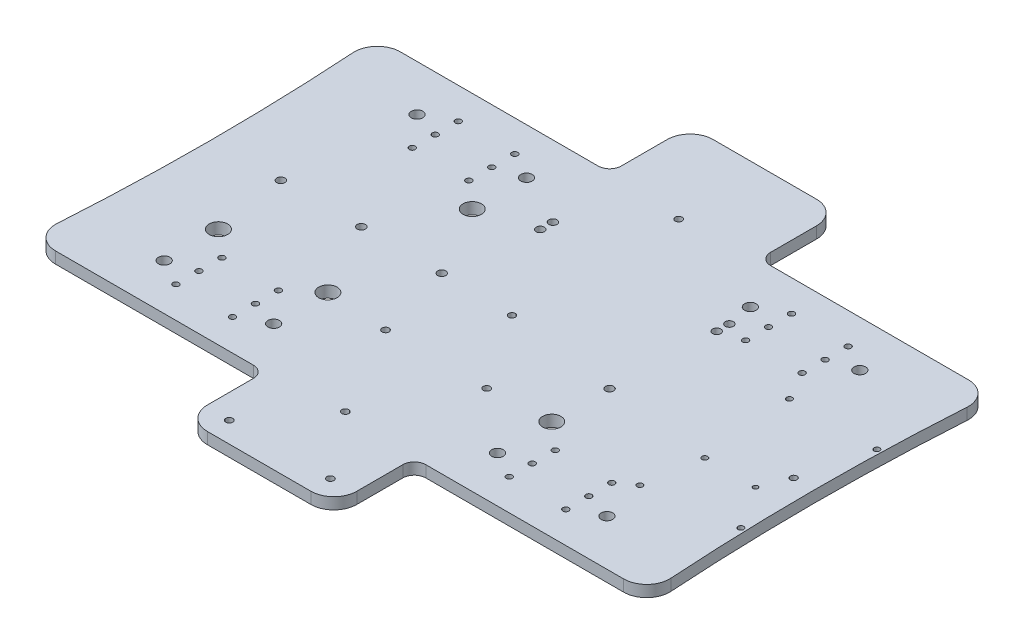
from build123d import *

# Parameters (mm, degrees)
SKETCH1_R              = 1.651
SKETCH1_R_2            = 1.8415
SKETCH1_R_3            = 1.905
SKETCH1_R_4            = 3.175
SKETCH1_R_5            = 1.315256363
SKETCH1_R_6            = 1.5621
SKETCH1_R_7            = 5.08
SKETCH1_R_8            = 2.2479
BOSS_EXTRUDE1_DEPTH    = 6.35
FILLET_OUTER_CORNERS_R = 12.7
FILLET_INNER_CORNERS_R = 6.35
SKETCH2_R              = 5.08
CUT_EXTRUDE1_DEPTH     = 220.86103505


with BuildPart() as part:
    # Sketch1 → Boss-Extrude1 (new body)
    with BuildSketch(Plane(origin=(0, 0, 0), x_dir=(1, 0, 0), z_dir=(0, 1, 0))):
        with BuildLine():
            Line((-142.875, 95.25), (-41.275, 95.25))
            Line((-41.275, 95.25), (-41.275, 139.7))
            Line((-41.275, 139.7), (41.275, 139.7))
            Line((41.275, 139.7), (41.275, 95.25))
            Line((41.275, 95.25), (142.875, 95.25))
            Line((142.875, 95.25), (170.571792564, 95.25))
            ThreePointArc((170.571792564, 95.25), (166.994880438, 0), (170.571792564, -95.25))
            Line((170.571792564, -95.25), (142.875, -95.25))
            Line((142.875, -95.25), (41.275, -95.25))
            Line((41.275, -95.25), (41.275, -139.7))
            Line((41.275, -139.7), (-41.275, -139.7))
            Line((-41.275, -139.7), (-41.275, -95.25))
            Line((-41.275, -95.25), (-142.875, -95.25))
            Line((-142.875, -95.25), (-170.571792564, -95.25))
            ThreePointArc((-170.571792564, -95.25), (-166.994880438, 0), (-170.571792564, 95.25))
            Line((-170.571792564, 95.25), (-142.875, 95.25))
        make_face()
        with Locations(Location((-107.696, 77.978, 0), (0, 0, 270))):
            Circle(SKETCH1_R, mode=Mode.SUBTRACT)
        with Locations(Location((-107.696, 65.278, 0), (0, 0, 270))):
            Circle(SKETCH1_R, mode=Mode.SUBTRACT)
        with Locations(Location((-107.696, 52.578, 0), (0, 0, 270))):
            Circle(SKETCH1_R, mode=Mode.SUBTRACT)
        with Locations(Location((-76.454, 77.978, 0), (0, 0, 90))):
            Circle(SKETCH1_R, mode=Mode.SUBTRACT)
        with Locations(Location((-76.454, 65.278, 0), (0, 0, 90))):
            Circle(SKETCH1_R, mode=Mode.SUBTRACT)
        with Locations(Location((-76.454, 52.578, 0), (0, 0, 90))):
            Circle(SKETCH1_R, mode=Mode.SUBTRACT)
        with Locations(Location((76.454, 52.578, 0), (0, 0, 270))):
            Circle(SKETCH1_R, mode=Mode.SUBTRACT)
        with Locations(Location((107.696, 52.578, 0), (0, 0, 90))):
            Circle(SKETCH1_R, mode=Mode.SUBTRACT)
        with Locations(Location((76.454, 65.278, 0), (0, 0, 270))):
            Circle(SKETCH1_R, mode=Mode.SUBTRACT)
        with Locations(Location((107.696, 65.278, 0), (0, 0, 90))):
            Circle(SKETCH1_R, mode=Mode.SUBTRACT)
        with Locations(Location((76.454, 77.978, 0), (0, 0, 270))):
            Circle(SKETCH1_R, mode=Mode.SUBTRACT)
        with Locations(Location((107.696, 77.978, 0), (0, 0, 90))):
            Circle(SKETCH1_R, mode=Mode.SUBTRACT)
        with Locations(Location((76.454, -52.578, 0), (0, 0, 90))):
            Circle(SKETCH1_R, mode=Mode.SUBTRACT)
        with Locations(Location((107.696, -52.578, 0), (0, 0, 270))):
            Circle(SKETCH1_R, mode=Mode.SUBTRACT)
        with Locations(Location((107.696, -65.278, 0), (0, 0, 270))):
            Circle(SKETCH1_R, mode=Mode.SUBTRACT)
        with Locations(Location((76.454, -65.278, 0), (0, 0, 90))):
            Circle(SKETCH1_R, mode=Mode.SUBTRACT)
        with Locations(Location((107.696, -77.978, 0), (0, 0, 270))):
            Circle(SKETCH1_R, mode=Mode.SUBTRACT)
        with Locations(Location((76.454, -77.978, 0), (0, 0, 90))):
            Circle(SKETCH1_R, mode=Mode.SUBTRACT)
        with Locations(Location((-76.454, -52.578, 0), (0, 0, 270))):
            Circle(SKETCH1_R, mode=Mode.SUBTRACT)
        with Locations(Location((-107.696, -52.578, 0), (0, 0, 90))):
            Circle(SKETCH1_R, mode=Mode.SUBTRACT)
        with Locations(Location((-76.454, -65.278, 0), (0, 0, 270))):
            Circle(SKETCH1_R, mode=Mode.SUBTRACT)
        with Locations(Location((-107.696, -65.278, 0), (0, 0, 90))):
            Circle(SKETCH1_R, mode=Mode.SUBTRACT)
        with Locations(Location((-76.454, -77.978, 0), (0, 0, 270))):
            Circle(SKETCH1_R, mode=Mode.SUBTRACT)
        with Locations(Location((-107.696, -77.978, 0), (0, 0, 90))):
            Circle(SKETCH1_R, mode=Mode.SUBTRACT)
        with Locations(Location((155.575, 0, 0), (0, 0, 270))):
            Circle(SKETCH1_R_2, mode=Mode.SUBTRACT)
        with Locations(Location((-27.94, -128.27, 0), (0, 0, 270))):
            Circle(SKETCH1_R_3, mode=Mode.SUBTRACT)
        with Locations(Location((27.94, -128.27, 0), (0, 0, 270))):
            Circle(SKETCH1_R_3, mode=Mode.SUBTRACT)
        with Locations(Location((-27.94, -41.91, 0), (0, 0, 90))):
            Circle(SKETCH1_R_3, mode=Mode.SUBTRACT)
        with Locations(Location((27.94, -41.91, 0), (0, 0, 90))):
            Circle(SKETCH1_R_3, mode=Mode.SUBTRACT)
        with Locations(Location((0, 0, 0), (0, 0, 270))):
            Circle(SKETCH1_R_2, mode=Mode.SUBTRACT)
        with Locations(Location((-122.311792564, 69.85, 0), (0, 0, 270))):
            Circle(SKETCH1_R_4, mode=Mode.SUBTRACT)
        with Locations(Location((-61.838207436, 69.85, 0), (0, 0, 90))):
            Circle(SKETCH1_R_4, mode=Mode.SUBTRACT)
        with Locations(Location((-61.838207436, -69.85, 0), (0, 0, 270))):
            Circle(SKETCH1_R_4, mode=Mode.SUBTRACT)
        with Locations(Location((-122.311792564, -69.85, 0), (0, 0, 90))):
            Circle(SKETCH1_R_4, mode=Mode.SUBTRACT)
        with Locations(Location((61.838207436, -69.85, 0), (0, 0, 90))):
            Circle(SKETCH1_R_4, mode=Mode.SUBTRACT)
        with Locations(Location((122.311792564, -69.85, 0), (0, 0, 270))):
            Circle(SKETCH1_R_4, mode=Mode.SUBTRACT)
        with Locations(Location((61.838207436, 69.85, 0), (0, 0, 270))):
            Circle(SKETCH1_R_4, mode=Mode.SUBTRACT)
        with Locations(Location((122.311792564, 69.85, 0), (0, 0, 90))):
            Circle(SKETCH1_R_4, mode=Mode.SUBTRACT)
        with Locations(Location((149.480692766, -14.9479, 0), (0, 0, 270))):
            Circle(SKETCH1_R_5, mode=Mode.SUBTRACT)
        with Locations(Location((121.464492766, -14.9479, 0), (0, 0, 270))):
            Circle(SKETCH1_R_6, mode=Mode.SUBTRACT)
        with Locations(Location((116.586, -45.9486, 0), (0, 0, 270))):
            Circle(SKETCH1_R_6, mode=Mode.SUBTRACT)
        with Locations(Location((164.9222, -38.4556, 0), (0, 0, 270))):
            Circle(SKETCH1_R_6, mode=Mode.SUBTRACT)
        with Locations(Location((164.9222, 36.6776, 0), (0, 0, 270))):
            Circle(SKETCH1_R_6, mode=Mode.SUBTRACT)
        with Locations(Location((116.586, 36.6776, 0), (0, 0, 270))):
            Circle(SKETCH1_R_6, mode=Mode.SUBTRACT)
        with Locations(Location((0, -92.075, 0), (0, 0, 270))):
            Circle(SKETCH1_R_3, mode=Mode.SUBTRACT)
        with Locations(Location((0, 92.075, 0), (0, 0, 270))):
            Circle(SKETCH1_R_3, mode=Mode.SUBTRACT)
        with Locations(Location((-61.838207436, -39.878, 0), (0, 0, 270))):
            Circle(SKETCH1_R_7, mode=Mode.SUBTRACT)
        with Locations(Location((-122.311792564, -39.878, 0), (0, 0, 270))):
            Circle(SKETCH1_R_7, mode=Mode.SUBTRACT)
        with Locations(Location((61.838207436, -39.878, 0), (0, 0, 90))):
            Circle(SKETCH1_R_7, mode=Mode.SUBTRACT)
        with Locations(Location((62.026925824, -8.128150569, 0), (0, 0, 270))):
            Circle(SKETCH1_R_8, mode=Mode.SUBTRACT)
        with Locations(Location((64.176925824, 48.924363993, 0), (0, 0, 270))):
            Circle(SKETCH1_R_8, mode=Mode.SUBTRACT)
        with Locations(Location((64.176925824, 55.924363993, 0), (0, 0, 270))):
            Circle(SKETCH1_R_8, mode=Mode.SUBTRACT)
        with Locations(Location((-33.323074176, 55.924363993, 0), (0, 0, 270))):
            Circle(SKETCH1_R_8, mode=Mode.SUBTRACT)
        with Locations(Location((-33.323074176, 48.924363993, 0), (0, 0, 270))):
            Circle(SKETCH1_R_8, mode=Mode.SUBTRACT)
        with Locations(Location((-39.573074176, 0.761849431, 0), (0, 0, 270))):
            Circle(SKETCH1_R_8, mode=Mode.SUBTRACT)
        with Locations(Location((-84.023074176, 0.761849431, 0), (0, 0, 270))):
            Circle(SKETCH1_R_8, mode=Mode.SUBTRACT)
        with Locations(Location((-128.473074176, 0.761849431, 0), (0, 0, 270))):
            Circle(SKETCH1_R_8, mode=Mode.SUBTRACT)
    extrude(amount=BOSS_EXTRUDE1_DEPTH)

    # Fillet_Outer_Corners
    fillet_outer_corners_edges = [part.edges().sort_by_distance(p)[0] for p in [
        (-170.571792564, 3.175, 95.25),
        (-170.571792564, 3.175, -95.25),
        (-41.275, 3.175, -139.7),
        (41.275, 3.175, -139.7),
        (170.571792564, 3.175, -95.25),
        (170.571792564, 3.175, 95.25),
        (41.275, 3.175, 139.7),
        (-41.275, 3.175, 139.7),
    ]]
    fillet(fillet_outer_corners_edges, radius=FILLET_OUTER_CORNERS_R)

    # Fillet_Inner_Corners
    fillet_inner_corners_edges = [part.edges().sort_by_distance(p)[0] for p in [
        (-41.275, 3.175, -95.25),
        (41.275, 3.175, -95.25),
        (41.275, 3.175, 95.25),
        (-41.275, 3.175, 95.25),
    ]]
    fillet(fillet_inner_corners_edges, radius=FILLET_INNER_CORNERS_R)

    # Sketch2 → Cut-Extrude1 (cut, through all)
    with BuildSketch(Plane(origin=(0, 6.35, 0), x_dir=(1, 0, 0), z_dir=(0, 1, 0))):
        with Locations(Location((-61.838207436, 39.878, 0), (0, 0, 90))):
            Circle(SKETCH2_R)
    extrude(amount=-CUT_EXTRUDE1_DEPTH, mode=Mode.SUBTRACT)


solid = part.part
